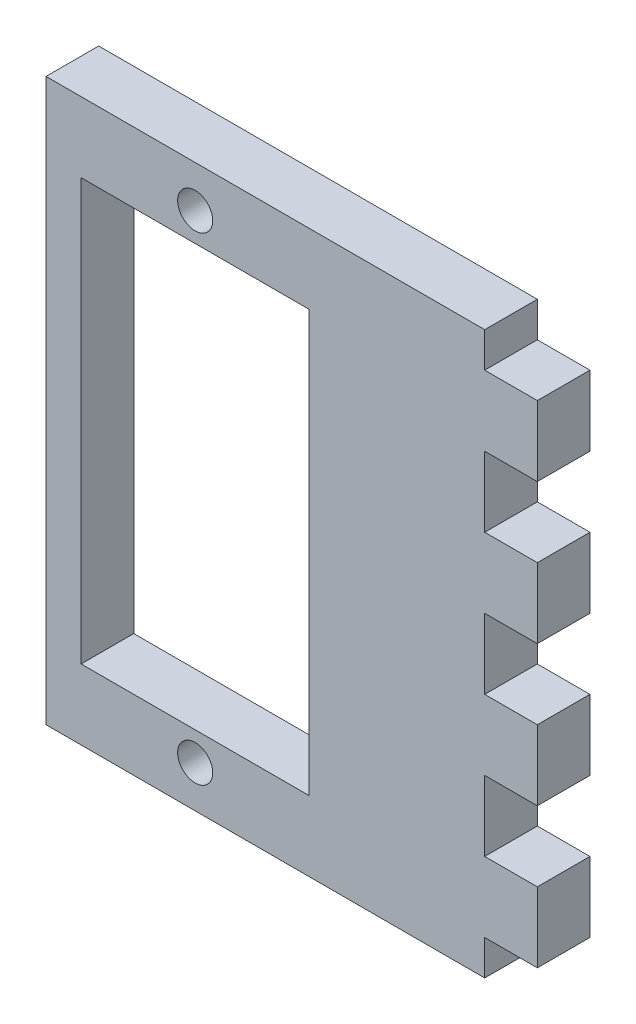
from build123d import *

# Parameters (mm, degrees)
SKETCH1_R           = 1
SKETCH1_W           = 13
SKETCH1_H           = 24
BOSS_EXTRUDE1_DEPTH = 3


with BuildPart() as part:
    # Sketch1 → Boss-Extrude1 (new body)
    with BuildSketch(Plane.XY):
        Polygon((16.5, 14), (19.5, 14), (19.5, 10), (16.5, 10), (16.5, 6), (19.5, 6), (19.5, 2), (16.5, 2), (16.5, -2), (19.5, -2), (19.5, -6), (16.5, -6), (16.5, -10), (19.5, -10), (19.5, -14), (16.5, -14), (16.5, -16), (-8.5, -16), (-8.5, 16), (16.5, 16), align=None)
        with Locations((0, 13.625)):
            Circle(SKETCH1_R, mode=Mode.SUBTRACT)
        with Locations(Location((0, -13.625, 0), (0, 0, 180))):
            Circle(SKETCH1_R, mode=Mode.SUBTRACT)
        Rectangle(SKETCH1_W, SKETCH1_H, mode=Mode.SUBTRACT)
    extrude(amount=BOSS_EXTRUDE1_DEPTH)


solid = part.part
